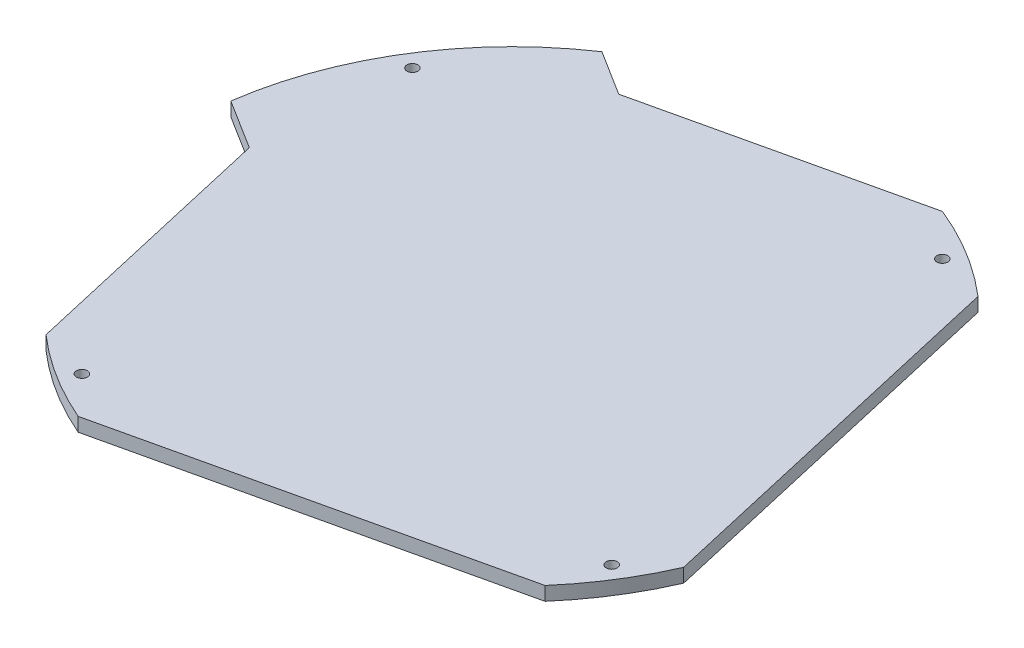
from build123d import *

# Parameters (mm, degrees)
SALIENTE_EXTRUIR1_DEPTH = 5
CROQUIS3_R              = 2
CORTAR_EXTRUIR1_DEPTH   = 10


with BuildPart() as part:
    # Croquis1 → Saliente-Extruir1 (new body)
    with BuildSketch(Plane(origin=(0, 0, 0), x_dir=(1, 0, 0), z_dir=(0, 1, 0))):
        with BuildLine():
            Line((391.11715601, -589.26903854), (409.134507606, -600.572222265))
            Line((409.134507606, -600.572222265), (431.070113816, -696.364244316))
            ThreePointArc((431.070113816, -696.364244316), (446.060284595, -707.511220058), (462.598816983, -716.196681165))
            Line((462.598816983, -716.196681165), (600.572192141, -684.601882766))
            ThreePointArc((600.572192141, -684.601882766), (611.492139331, -669.889063268), (620.044894414, -653.685277145))
            Line((620.044894414, -653.685277145), (588.295487999, -515.036734211))
            ThreePointArc((588.295487999, -515.036734211), (572.526223432, -503.540761802), (555.102156346, -494.752760164))
            Line((555.102156346, -494.752760164), (459.421279691, -516.662914968))
            Line((459.421279691, -516.662914968), (442.992177211, -506.356119167))
            ThreePointArc((442.992177211, -506.356119167), (408.224347097, -542.287830533), (391.11715601, -589.26903854))
        make_face()
    extrude(amount=SALIENTE_EXTRUIR1_DEPTH)

    # Croquis3 → Cortar-Extruir1 (cut)
    with BuildSketch(Plane.XZ):
        with Locations(Location((449.910379391, 702.169476818, 0), (0, 0, 270))):
            Circle(CROQUIS3_R)
        with Locations(Location((413.720365983, 545.892005433, 0), (0, 0, 270))):
            Circle(CROQUIS3_R)
        with Locations(Location((569.997837367, 509.701992025, 0), (0, 0, 270))):
            Circle(CROQUIS3_R)
        with Locations(Location((606.187850775, 665.97946341, 0), (0, 0, 270))):
            Circle(CROQUIS3_R)
    extrude(amount=-CORTAR_EXTRUIR1_DEPTH, mode=Mode.SUBTRACT)


solid = part.part
